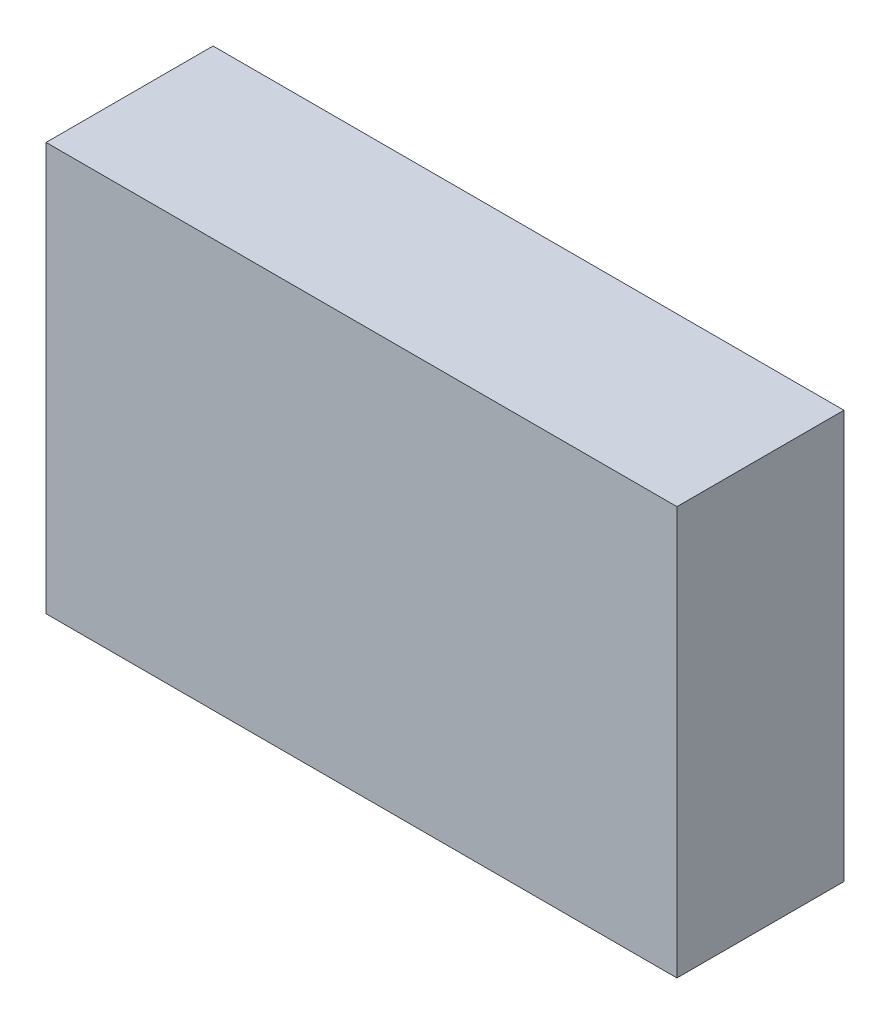
from build123d import *

# Parameters (mm, degrees)
SKETCH1_W           = 215.9
SKETCH1_H           = 139.7
BOSS_EXTRUDE1_DEPTH = 57.15


with BuildPart() as part:
    # Sketch1 → Boss-Extrude1 (new body)
    with BuildSketch(Plane.XY):
        Rectangle(SKETCH1_W, SKETCH1_H)
    extrude(amount=BOSS_EXTRUDE1_DEPTH)


solid = part.part
